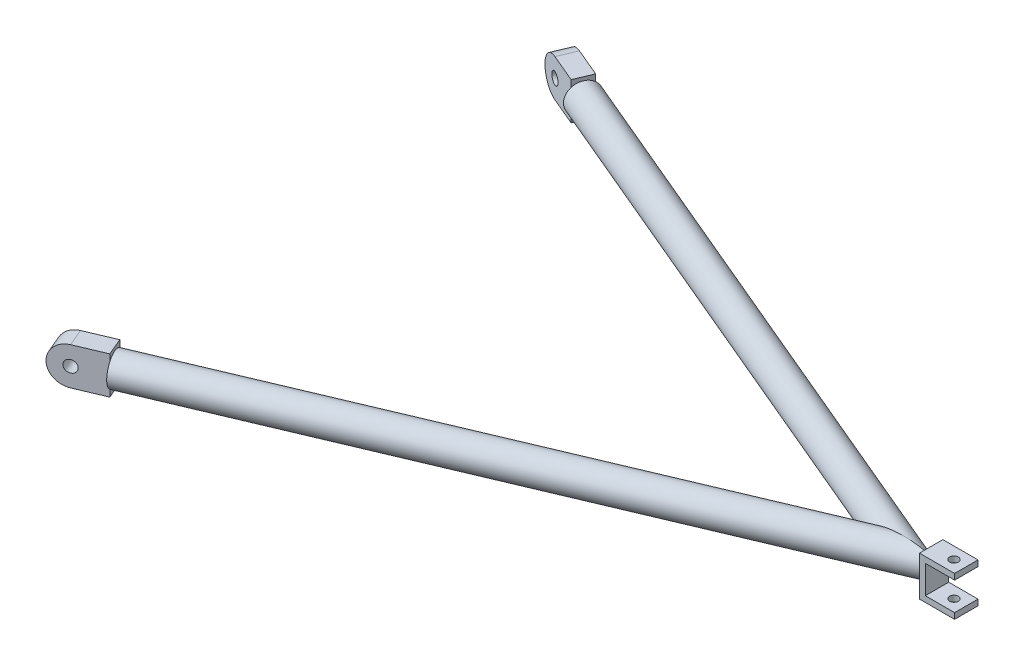
from build123d import *

# Parameters (mm, degrees)
SKETCH2_R                      = 8.255
BOSS_EXTRUDE1_DEPTH            = 6.35
BOSS_EXTRUDE1_DEPTH_BACK       = 6.35
BOSS_EXTRUDE2_DEPTH            = 10.16
BOSS_EXTRUDE2_DEPTH_BACK       = 16.256
SKETCH4_W                      = 10.16
SKETCH4_H                      = 20.32
BOSS_EXTRUDE3_DEPTH            = 10.16
BOSS_EXTRUDE3_DEPTH_BACK       = 16.51
SKETCH5_W                      = 10.16
SKETCH5_H                      = 20.32
CUT_EXTRUDE3_DEPTH             = 361.571509311
CUT_EXTRUDE4_DEPTH             = 357.967583958
CUT_EXTRUDE5_DEPTH             = 16.51
CUT_EXTRUDE6_START             = -16.256
CUT_EXTRUDE6_DEPTH             = 16.256
E_0_25_DIAMETER_HOLE2_D        = 6.35
E_0_25_DIAMETER_HOLE2_DEPTH    = 19.05
E_0_25_DIAMETER_HOLE2_TIP      = 1.907732465
E_0_25_DIAMETER_HOLE3_D        = 6.35
E_0_25_DIAMETER_HOLE3_DEPTH    = 19.05
E_0_25_DIAMETER_HOLE3_TIP      = 1.907732465
CUT_EXTRUDE7_DEPTH             = 360.454492653
F_3_16_0_1875_DIAMETER_HOLE1_D = 4.7625


with BuildPart() as part:
    # Sweep1: sweep along a path in Sketch1
    with BuildLine(Plane(origin=(0, 0, 0), x_dir=(1, 0, 0), z_dir=(0, 1, 0))) as sweep1_path:
        Line((-315.908511281, -133.35), (0, 0))
        Line((0, 0), (-315.908511281, 133.35))
    # Sketch2 → Sweep1 (sweep)
    with BuildSketch(Plane(origin=(-315.908511281, 0, 133.35), x_dir=(-0.3888888888888888, 0, -0.9212846639876112), z_dir=(0.9212846639876112, 0, -0.3888888888888888))):
        Circle(SKETCH2_R)
    sweep(path=sweep1_path.line, transition=Transition.RIGHT)

    # Sketch3 → Boss-Extrude1 (add, two sides: drawn at the far end of the back side and taken through both)
    with BuildSketch(Plane.XY.offset(-BOSS_EXTRUDE1_DEPTH_BACK)):
        Polygon((33.931753368, 10.795), (14.877142857, 10.795), (14.877142857, -10.795), (33.931753368, -10.795), (33.931753368, -7.62), (18.052142857, -7.62), (18.052142857, 7.62), (33.931753368, 7.62), align=None)
    extrude(amount=BOSS_EXTRUDE1_DEPTH + BOSS_EXTRUDE1_DEPTH_BACK)

    # Sketch4 → Boss-Extrude2 (add, two sides: drawn at the far end of the back side and taken through both)
    with BuildSketch(Plane(origin=(-315.908511281, 0, 133.35), x_dir=(0.38888888888888873, 0, 0.9212846639876112), z_dir=(-0.9212846639876112, 0, 0.38888888888888873)).offset(-BOSS_EXTRUDE2_DEPTH_BACK)):
        Rectangle(SKETCH4_W, SKETCH4_H)
    extrude(amount=BOSS_EXTRUDE2_DEPTH + BOSS_EXTRUDE2_DEPTH_BACK)

    # Sketch5 → Boss-Extrude3 (add, two sides: drawn at the far end of the back side and taken through both)
    with BuildSketch(Plane(origin=(-315.908511281, 0, -133.35), x_dir=(-0.38888888888888895, 0, 0.921284663987611), z_dir=(-0.921284663987611, 0, -0.38888888888888895)).offset(-BOSS_EXTRUDE3_DEPTH_BACK)):
        Rectangle(SKETCH5_W, SKETCH5_H)
    extrude(amount=BOSS_EXTRUDE3_DEPTH + BOSS_EXTRUDE3_DEPTH_BACK)

    # Sketch12 → Cut-Extrude3 (cut, through all)
    with BuildSketch(Plane(origin=(1.975555556, 0, -4.680126093), x_dir=(-0.9212846639876111, 0, -0.38888888888888895), z_dir=(0.3888888888888889, 0, -0.921284663987611))):
        with BuildLine():
            Line((353.06, 0), (353.06, 10.16))
            Line((353.06, 10.16), (342.9, 10.16))
            ThreePointArc((342.9, 10.16), (350.084204897, 7.184204897), (353.06, 0))
        make_face()
    cut_extrude3 = extrude(amount=-CUT_EXTRUDE3_DEPTH, mode=Mode.SUBTRACT)

    # Sketch13 → Cut-Extrude4 (cut, through all)
    with BuildSketch(Plane(origin=(-1.975555556, 0, -4.680126093), x_dir=(-0.9212846639876111, 0, 0.3888888888888888), z_dir=(-0.3888888888888888, 0, -0.9212846639876111))):
        with BuildLine():
            Line((353.06, 10.16), (342.9, 10.16))
            ThreePointArc((342.9, 10.16), (350.084204897, 7.184204897), (353.06, 0))
            Line((353.06, 0), (353.06, 10.16))
        make_face()
        with BuildLine():
            Line((353.06, -10.16), (353.06, 0))
            ThreePointArc((353.06, 0), (350.084204897, -7.184204897), (342.9, -10.16))
            Line((342.9, -10.16), (353.06, -10.16))
        make_face()
    extrude(amount=-CUT_EXTRUDE4_DEPTH, mode=Mode.SUBTRACT)

    # Mirror3: Cut-Extrude3 across plane
    add(cut_extrude3.mirror(Plane.ZX), mode=Mode.SUBTRACT)

    # Sketch14 → Cut-Extrude5 (cut)
    with BuildSketch(Plane(origin=(-315.908511281, 0, -133.35), x_dir=(-0.38888888888888906, 0, 0.921284663987611), z_dir=(-0.9212846639876111, 0, -0.3888888888888891))):
        with BuildLine():
            Line((5.08, 6.506813736), (5.08, -6.506813736))
            ThreePointArc((5.08, -6.506813736), (8.255, 0), (5.08, 6.506813736))
        make_face()
        with BuildLine():
            Line((-5.08, -6.506813736), (-5.08, 6.506813736))
            ThreePointArc((-5.08, 6.506813736), (-8.255, 0), (-5.08, -6.506813736))
        make_face()
    extrude(amount=-CUT_EXTRUDE5_DEPTH, mode=Mode.SUBTRACT)

    # Sketch15 → Cut-Extrude6 (cut)
    with BuildSketch(Plane(origin=(-315.908511281, 0, 133.35), x_dir=(0.38888888888888884, 0, 0.9212846639876111), z_dir=(-0.9212846639876111, 0, 0.38888888888888884)).offset(CUT_EXTRUDE6_START)):
        with BuildLine():
            Line((5.08, 6.506813736), (5.08, -6.506813736))
            ThreePointArc((5.08, -6.506813736), (8.255, 0), (5.08, 6.506813736))
        make_face()
        with BuildLine():
            Line((-5.08, -6.506813736), (-5.08, 6.506813736))
            ThreePointArc((-5.08, 6.506813736), (-8.255, 0), (-5.08, -6.506813736))
        make_face()
    extrude(amount=CUT_EXTRUDE6_DEPTH, mode=Mode.SUBTRACT)

    # E (0.25) Diameter Hole2
    with Locations(Plane(origin=(1.975555556, 0, -4.680126093), x_dir=(-0.9212846639876111, 0, -0.38888888888888895), z_dir=(0.3888888888888889, 0, -0.921284663987611))):
        with Locations((342.9, 0)):
            Hole(E_0_25_DIAMETER_HOLE2_D / 2, depth=E_0_25_DIAMETER_HOLE2_DEPTH)
            with Locations((0, 0, -(E_0_25_DIAMETER_HOLE2_DEPTH + E_0_25_DIAMETER_HOLE2_TIP / 2))):  # 118° drill point
                Cone(0, E_0_25_DIAMETER_HOLE2_D / 2, E_0_25_DIAMETER_HOLE2_TIP, mode=Mode.SUBTRACT)

    # E (0.25) Diameter Hole3
    with Locations(Plane(origin=(-1.975555556, 0, -4.680126093), x_dir=(-0.9212846639876111, 0, 0.3888888888888888), z_dir=(-0.3888888888888888, 0, -0.9212846639876111))):
        with Locations((342.9, 0)):
            Hole(E_0_25_DIAMETER_HOLE3_D / 2, depth=E_0_25_DIAMETER_HOLE3_DEPTH)
            with Locations((0, 0, -(E_0_25_DIAMETER_HOLE3_DEPTH + E_0_25_DIAMETER_HOLE3_TIP / 2))):  # 118° drill point
                Cone(0, E_0_25_DIAMETER_HOLE3_D / 2, E_0_25_DIAMETER_HOLE3_TIP, mode=Mode.SUBTRACT)

    # Sketch20 → Cut-Extrude7 (cut, through all)
    with BuildSketch(Plane.XY.offset(6.35)):
        with BuildLine():
            Line((18.052142857, 4.342893612), (18.052142857, -4.342893612))
            add(Edge.make_bspline(
                [(18.052142857, -4.342893612), (24.960559943, 0), (18.052142857, 4.342893612)],
                knots=[5.729186052, 5.729186052, 5.729186052, 6.837184562, 6.837184562, 6.837184562], degree=2, weights=[1, 0.85042735, 1]))
        make_face()
    extrude(amount=-CUT_EXTRUDE7_DEPTH, mode=Mode.SUBTRACT)

    # 3/16 (0.1875) Diameter Hole1 (through all)
    with Locations(Plane(origin=(0, 10.795, 0), x_dir=(1, 0, 0), z_dir=(0, 1, 0))):
        with Locations((27.239219, 0)):
            Hole(F_3_16_0_1875_DIAMETER_HOLE1_D / 2)


solid = part.part
